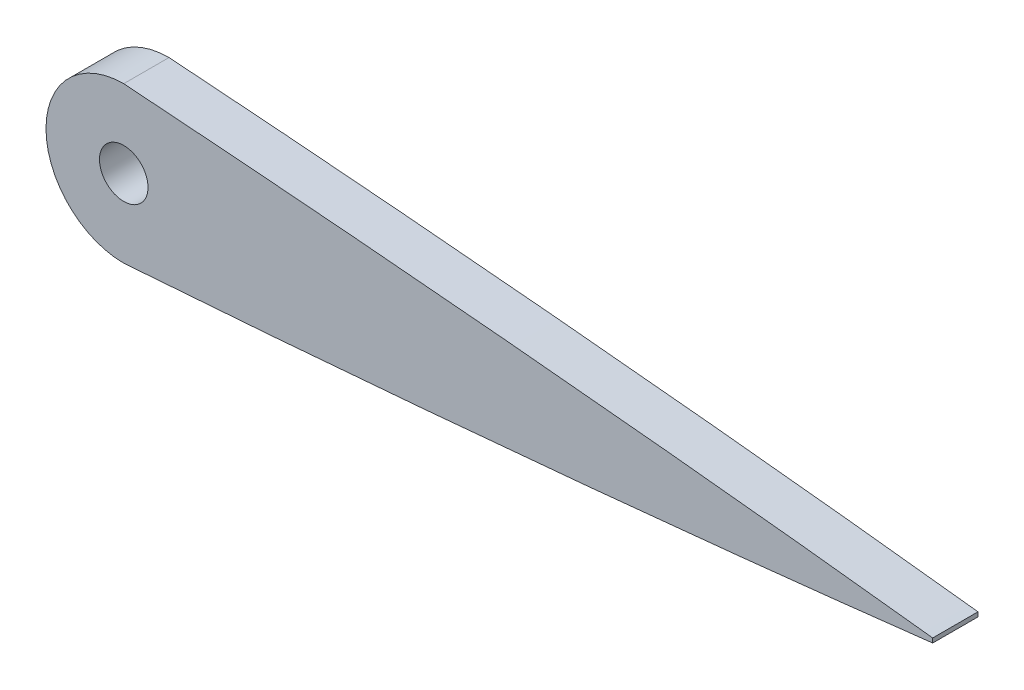
from build123d import *

# Parameters (mm, degrees)
SKETCH_1_R      = 1.5
EXTRUDE_1_DEPTH = 1.4


with BuildPart() as part:
    # Эскиз1 → Бобышка-Вытянуть1 (new, symmetric)
    with BuildSketch(Plane.XY):
        with BuildLine():
            Line((200, -0.1365), (200, 0.1365))
            add(Edge.make_bspline(
                [(200, 0.1365), (199.68803342, 0.172881569), (198.81669122, 0.27449757), (197.235914613, 0.456098486), (195.145010046, 0.692291497), (192.701519493, 0.962451868), (189.981579718, 1.256111468), (187.036509642, 1.566007991), (183.904963565, 1.886673282), (179.441732645, 2.330723386), (174.819068239, 2.769921708), (170.064960651, 3.20022732), (166.382173561, 3.522091337), (162.644406173, 3.836797902), (158.865943793, 4.14237985), (155.059961592, 4.437010481), (152.101523013, 4.655245952), (150.413140573, 4.775462142), (150, 4.804613846)],
                knots=[0, 0, 0, 0, 0.007144724, 0.019955661, 0.036196061, 0.055011184, 0.075878938, 0.098428866, 0.122375554, 0.147487885, 0.200459747, 0.22800517, 0.256076454, 0.284555151, 0.313332763, 0.342309554, 0.371392651, 0.380814152, 0.380814152, 0.380814152, 0.380814152], degree=3))
            ThreePointArc((150, 4.804613846), (145.195386154, 0), (150, -4.804613846))
            add(Edge.make_bspline(
                [(150, -4.804613846), (150.413140573, -4.775462142), (152.101523013, -4.655245952), (155.059961592, -4.437010481), (158.865943793, -4.14237985), (162.644406173, -3.836797902), (166.382173561, -3.522091337), (170.064960651, -3.20022732), (174.819068239, -2.769921708), (179.441732645, -2.330723386), (183.904963565, -1.886673282), (187.036509642, -1.566007991), (189.981579718, -1.256111468), (192.701519493, -0.962451868), (195.145010046, -0.692291497), (197.235914613, -0.456098486), (198.81669122, -0.27449757), (199.68803342, -0.172881569), (200, -0.1365)],
                knots=[0.619185848, 0.619185848, 0.619185848, 0.619185848, 0.628607349, 0.657690446, 0.686667237, 0.715444849, 0.743923546, 0.77199483, 0.799540253, 0.852512115, 0.877624446, 0.901571134, 0.924121062, 0.944988816, 0.963803939, 0.980044339, 0.992855276, 1, 1, 1, 1], degree=3))
        make_face()
        with Locations((150, 0)):
            Circle(SKETCH_1_R, mode=Mode.SUBTRACT)
    extrude(amount=EXTRUDE_1_DEPTH, both=True)


solid = part.part
